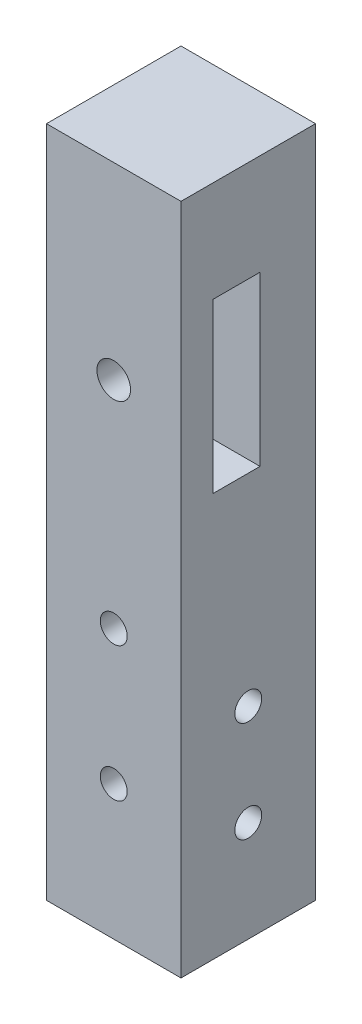
from build123d import *

# Parameters (mm, degrees)
SKETCH1_W           = 75.9
SKETCH1_H           = 100
BOSS_EXTRUDE1_DEPTH = 20
SKETCH2_R           = 2.5
CUT_EXTRUDE1_DEPTH  = 85.734786653
SKETCH3_W           = 27.95
SKETCH3_H           = 100
CUT_EXTRUDE2_DEPTH  = 85.734786653
SKETCH4_W           = 7
SKETCH4_H           = 25
CUT_EXTRUDE3_DEPTH  = 41
SKETCH5_R           = 2
CUT_EXTRUDE4_DEPTH  = 69.0951966
SKETCH6_R           = 2
CUT_EXTRUDE5_DEPTH  = 64.589352813


with BuildPart() as part:
    # Sketch1 → Boss-Extrude1 (new body)
    with BuildSketch(Plane.XY):
        with Locations((-21.517455621, 6.952662722)):
            Rectangle(SKETCH1_W, SKETCH1_H)
    extrude(amount=BOSS_EXTRUDE1_DEPTH)

    # Sketch2 → Cut-Extrude1 (cut, through all)
    with BuildSketch(Plane.XY.offset(20)):
        with Locations((-21.517455621, 28.952662722)):
            Circle(SKETCH2_R)
    extrude(amount=-CUT_EXTRUDE1_DEPTH, mode=Mode.SUBTRACT)

    # Sketch3 → Cut-Extrude2 (cut, through all)
    with BuildSketch(Plane.XY.offset(20)):
        with Locations((-45.492455621, 6.952662722)):
            Rectangle(SKETCH3_W, SKETCH3_H)
        with Locations((2.457544379, 6.952662722)):
            Rectangle(SKETCH3_W, SKETCH3_H)
    extrude(amount=-CUT_EXTRUDE2_DEPTH, mode=Mode.SUBTRACT)

    # Sketch4 → Cut-Extrude3 (cut)
    with BuildSketch(Plane(origin=(-11.517455621, 0, 0), x_dir=(0, 0, -1), z_dir=(1, 0, 0))):
        with Locations((-11.75, 29.452662722)):
            Rectangle(SKETCH4_W, SKETCH4_H)
    extrude(amount=-CUT_EXTRUDE3_DEPTH, mode=Mode.SUBTRACT)

    # Sketch5 → Cut-Extrude4 (cut, through all)
    with BuildSketch(Plane.XY.offset(20)):
        with Locations((-21.517455621, -3.047337278)):
            Circle(SKETCH5_R)
        with Locations((-21.517455621, -23.047337278)):
            Circle(SKETCH5_R)
    extrude(amount=-CUT_EXTRUDE4_DEPTH, mode=Mode.SUBTRACT)

    # Sketch6 → Cut-Extrude5 (cut, through all)
    with BuildSketch(Plane(origin=(-11.517455621, 0, 0), x_dir=(0, 0, -1), z_dir=(1, 0, 0))):
        with Locations(Location((-10, -13.047337278, 0), (0, 0, 90))):
            Circle(SKETCH6_R)
        with Locations(Location((-10, -28.047337278, 0), (0, 0, 90))):
            Circle(SKETCH6_R)
    extrude(amount=-CUT_EXTRUDE5_DEPTH, mode=Mode.SUBTRACT)


solid = part.part
